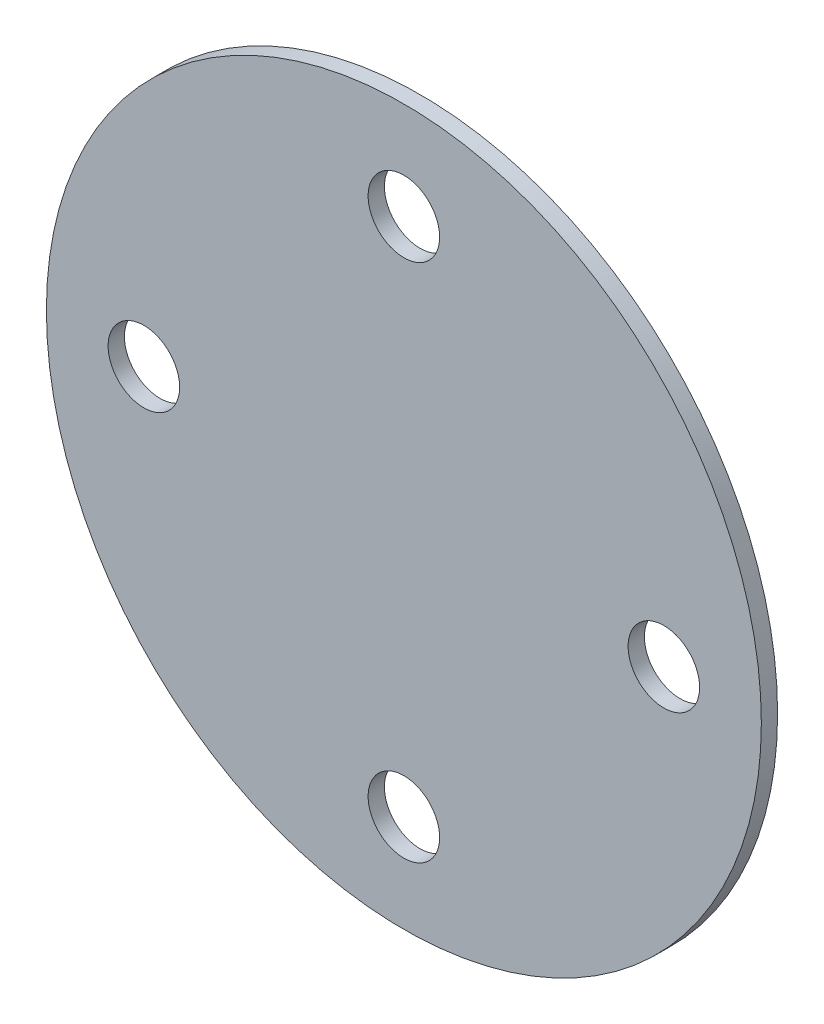
from build123d import *

# Parameters (mm, degrees)
ESQUISSE1_R        = 11
ESQUISSE1_R_2      = 1.1
BOSS_EXTRU_1_DEPTH = 0.5


with BuildPart() as part:
    # Esquisse1 → Boss.-Extru.1 (new body)
    with BuildSketch(Plane.XY):
        Circle(ESQUISSE1_R)
        with Locations((0, 8)):
            Circle(ESQUISSE1_R_2, mode=Mode.SUBTRACT)
        with Locations((8, 0)):
            Circle(ESQUISSE1_R_2, mode=Mode.SUBTRACT)
        with Locations((0, -8)):
            Circle(ESQUISSE1_R_2, mode=Mode.SUBTRACT)
        with Locations((-8, 0)):
            Circle(ESQUISSE1_R_2, mode=Mode.SUBTRACT)
    extrude(amount=BOSS_EXTRU_1_DEPTH)


solid = part.part
